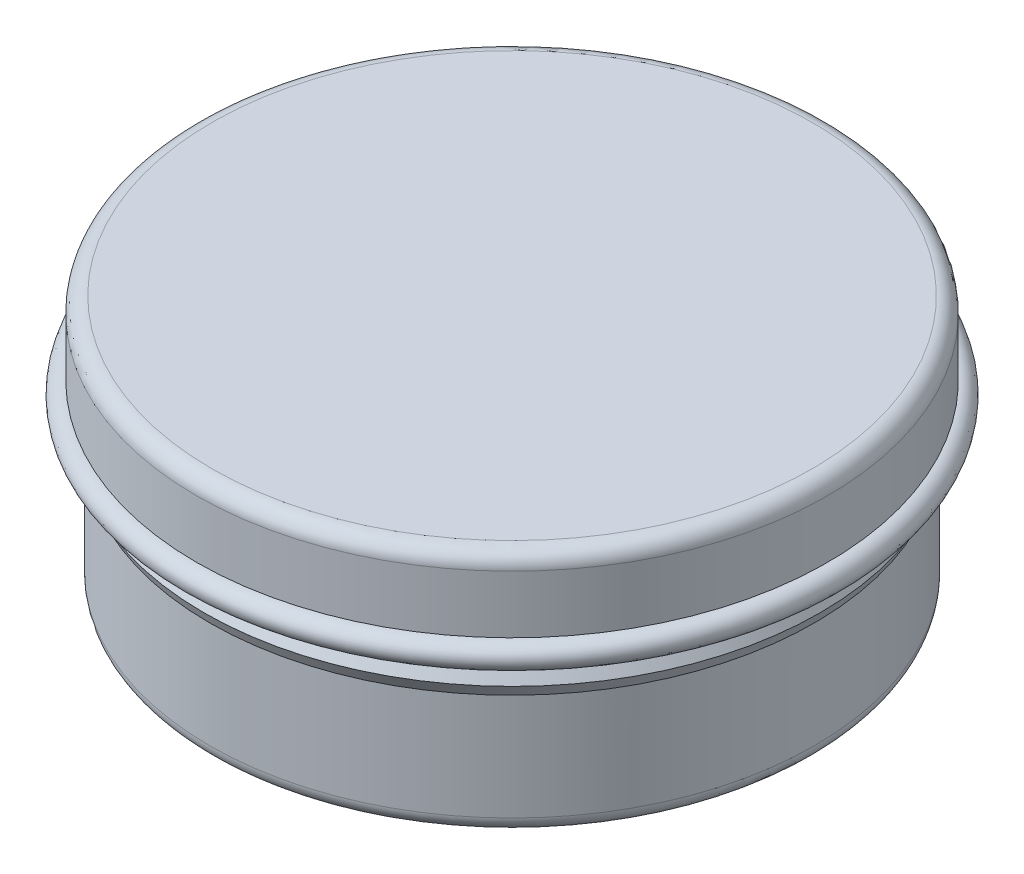
from build123d import *

# Parameters (mm, degrees)
FILLET1_R      = 1
SCALE1_SCALE_X = 1.05
SCALE1_SCALE_Y = 1.05
SCALE1_SCALE_Z = 1.05


with BuildPart() as part:
    # Sketch1 → Revolve1 (revolve)
    with BuildSketch(Plane.XY):
        with BuildLine():
            Line((0, 0), (-19.45, 0))
            Line((-19.45, 0), (-19.45, 7.84))
            Line((-19.45, 7.84), (-19.825, 8.597541722))
            Line((-19.825, 8.597541722), (-19.45, 9.355083444))
            Line((-19.45, 9.355083444), (-19.45, 10.04))
            Line((-19.45, 10.04), (-20.3, 10.04))
            add(Edge.make_bspline(
                [(-20.3, 11.64), (-21.2, 11.64), (-21.2, 10.84), (-21.2, 10.04), (-20.3, 10.04)],
                knots=[4.71238898, 4.71238898, 4.71238898, 6.283185307, 6.283185307, 7.853981634, 7.853981634, 7.853981634], degree=2, weights=[1, 0.707106781, 1, 0.707106781, 1]))
            Line((-20.3, 11.64), (-20.3, 16.35))
            Line((-20.3, 16.35), (0, 16.35))
            Line((0, 16.35), (0, 0))
        make_face()
    revolve(axis=Axis((0, 24.52235385, 0), (0, -1, 0)))

    # Fillet1
    fillet1_edges = [part.edges().sort_by_distance(p)[0] for p in [
        (20.3, 16.35, 0),
        (19.45, 0, 0),
    ]]
    fillet(fillet1_edges, radius=FILLET1_R)


with BuildPart() as part_1:
    # Scale1: scaled about (0, 0, 0)
    add(part.part.scale((SCALE1_SCALE_X, SCALE1_SCALE_Y, SCALE1_SCALE_Z), about=(0, 0, 0)))


solid = part_1.part
